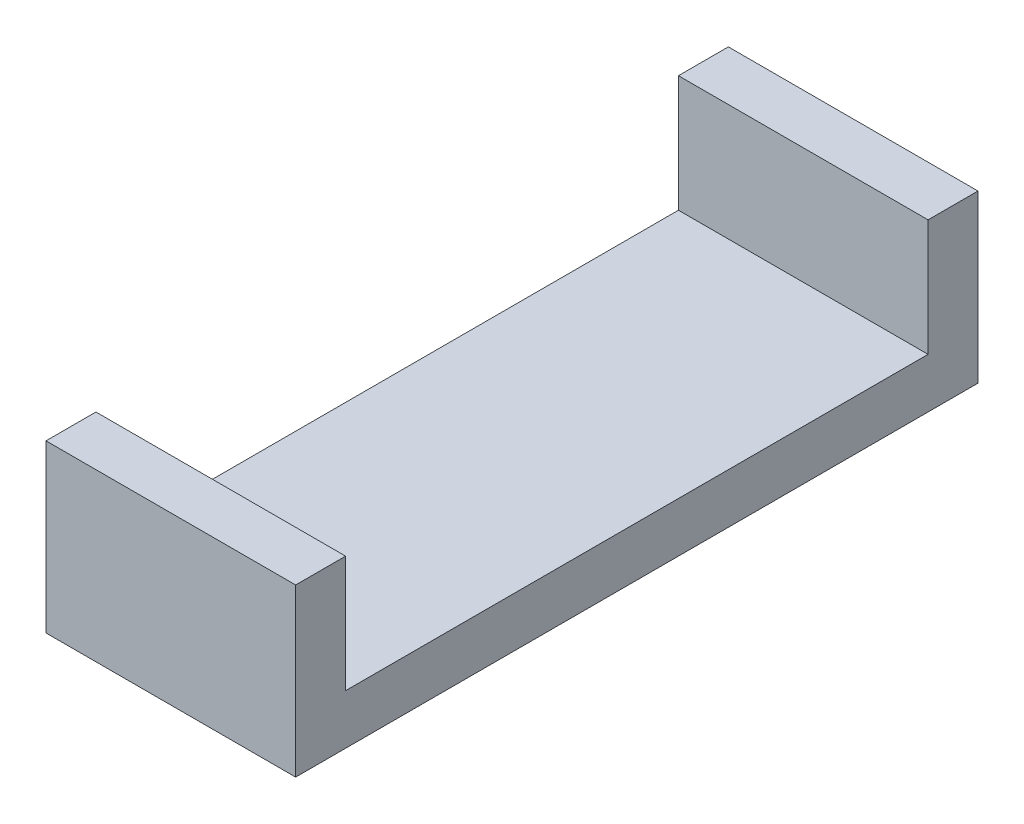
from build123d import *

# Parameters (mm, degrees)
SKETCH1_W           = 15
SKETCH1_H           = 41
BOSS_EXTRUDE3_DEPTH = 3
SKETCH3_W           = 15
SKETCH3_H           = 3
BOSS_EXTRUDE4_DEPTH = 7
SKETCH4_W           = 15
SKETCH4_H           = 3
BOSS_EXTRUDE5_DEPTH = 7


with BuildPart() as part:
    # Sketch1 → Boss-Extrude3 (new body)
    with BuildSketch(Plane(origin=(0, 0, 0), x_dir=(1, 0, 0), z_dir=(0, 1, 0))):
        Rectangle(SKETCH1_W, SKETCH1_H)
    extrude(amount=BOSS_EXTRUDE3_DEPTH)

    # Sketch3 → Boss-Extrude4 (add)
    with BuildSketch(Plane(origin=(0, 3, 0), x_dir=(1, 0, 0), z_dir=(0, 1, 0))):
        with Locations((0, -19)):
            Rectangle(SKETCH3_W, SKETCH3_H)
    extrude(amount=BOSS_EXTRUDE4_DEPTH)

    # Sketch4 → Boss-Extrude5 (add)
    with BuildSketch(Plane(origin=(0, 3, 0), x_dir=(1, 0, 0), z_dir=(0, 1, 0))):
        with Locations((0, 19)):
            Rectangle(SKETCH4_W, SKETCH4_H)
    extrude(amount=BOSS_EXTRUDE5_DEPTH)


solid = part.part
